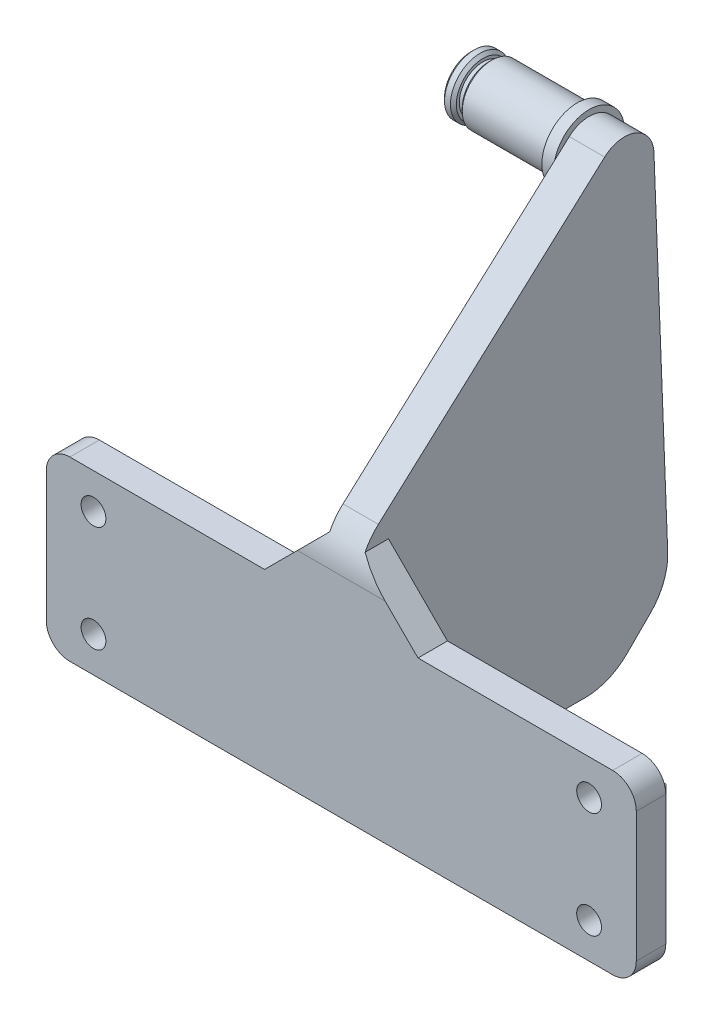
from build123d import *

# Parameters (mm, degrees)
SKETCH1_W           = 100
SKETCH1_H           = 30
BOSS_EXTRUDE1_DEPTH = 5
SKETCH2_W           = 6
SKETCH2_H           = 50
BOSS_EXTRUDE2_DEPTH = 30
SKETCH3_W           = 6
SKETCH3_H           = 52.5
BOSS_EXTRUDE3_DEPTH = 50
SKETCH4_R           = 5
BOSS_EXTRUDE4_DEPTH = 20
CHAMFER1_SIZE       = 10
FILLET1_R           = 10
CHAMFER2_SIZE       = 10
FILLET2_R           = 4
SKETCH5_W           = 100
SKETCH5_H           = 5
BOSS_EXTRUDE5_DEPTH = 10
CHAMFER3_SIZE       = 10
SKETCH7_R           = 2.1
CUT_EXTRUDE1_DEPTH  = 137.587883796
CUT_EXTRUDE2_DEPTH  = 108.075907654
FILLET3_R           = 10
SKETCH9_R           = 6
BOSS_EXTRUDE6_DEPTH = 2
CHAMFER4_SIZE       = 0.5
CUT_EXTRUDE3_START  = 1
SKETCH10_R          = 5
SKETCH10_R_2        = 4
CUT_EXTRUDE3_DEPTH  = 1
CHAMFER5_SIZE       = 0.5


with BuildPart() as part:
    # Sketch1 → Boss-Extrude1 (new body)
    with BuildSketch(Plane.XY):
        with Locations((50, 15)):
            Rectangle(SKETCH1_W, SKETCH1_H)
    extrude(amount=BOSS_EXTRUDE1_DEPTH)

    # Sketch2 → Boss-Extrude2 (add)
    with BuildSketch(Plane(origin=(0, 30, 0), x_dir=(1, 0, 0), z_dir=(0, 1, 0))):
        with Locations((50, 22.5)):
            Rectangle(SKETCH2_W, SKETCH2_H)
    extrude(amount=-BOSS_EXTRUDE2_DEPTH)

    # Sketch3 → Boss-Extrude3 (add)
    with BuildSketch(Plane(origin=(0, 30, 0), x_dir=(1, 0, 0), z_dir=(0, 1, 0))):
        with Locations((50, 21.25)):
            Rectangle(SKETCH3_W, SKETCH3_H)
    extrude(amount=BOSS_EXTRUDE3_DEPTH)

    # Sketch4 → Boss-Extrude4 (add)
    with BuildSketch(Plane.ZY.offset(-47)):
        with Locations((-40, 74)):
            Circle(SKETCH4_R)
    extrude(amount=BOSS_EXTRUDE4_DEPTH)

    # Chamfer1
    chamfer1_edges = [part.edges().sort_by_distance(p)[0] for p in [
        (50, 0, -47.5),
    ]]
    chamfer(chamfer1_edges, length=CHAMFER1_SIZE)

    # Fillet1
    fillet1_edges = [part.edges().sort_by_distance(p)[0] for p in [
        (50, 80, 5),
        (50, 80, -47.5),
    ]]
    fillet(fillet1_edges, radius=FILLET1_R)

    # Chamfer2
    chamfer2_edges = [part.edges().sort_by_distance(p)[0] for p in [
        (47, 30, 2.5),
        (53, 30, 2.5),
    ]]
    chamfer(chamfer2_edges, length=CHAMFER2_SIZE)

    # Fillet2
    fillet2_edges = [part.edges().sort_by_distance(p)[0] for p in [
        (0, 0, 2.5),
        (100, 0, 2.5),
        (100, 30, 2.5),
        (0, 30, 2.5),
    ]]
    fillet(fillet2_edges, radius=FILLET2_R)

    # Sketch5 → Boss-Extrude5 (add)
    with BuildSketch(Plane(origin=(0, 0, 0), x_dir=(-1, 0, 0), z_dir=(0, 0, -1))):
        with Locations((-50, 15)):
            Rectangle(SKETCH5_W, SKETCH5_H)
    extrude(amount=BOSS_EXTRUDE5_DEPTH)

    # Chamfer3
    chamfer3_edges = [part.edges().sort_by_distance(p)[0] for p in [
        (0, 15, -10),
        (100, 15, -10),
    ]]
    chamfer(chamfer3_edges, length=CHAMFER3_SIZE)

    # Sketch7 → Cut-Extrude1 (cut, through all)
    with BuildSketch(Plane(origin=(0, 0, 0), x_dir=(-1, 0, 0), z_dir=(0, 0, -1))):
        with Locations((-92, 24)):
            Circle(SKETCH7_R)
        with Locations((-8, 24)):
            Circle(SKETCH7_R)
        with Locations((-8, 6)):
            Circle(SKETCH7_R)
        with Locations((-92, 6)):
            Circle(SKETCH7_R)
    extrude(amount=-CUT_EXTRUDE1_DEPTH, mode=Mode.SUBTRACT)

    # Sketch8 → Cut-Extrude2 (cut, through all)
    with BuildSketch(Plane.ZY.offset(-47)):
        with BuildLine():
            Line((-36.644039957, 77.706417703), (5, 40))
            Line((5, 40), (5, 70))
            ThreePointArc((5, 70), (2.071067812, 77.071067812), (-5, 80))
            Line((-5, 80), (-37.5, 80))
            ThreePointArc((-37.5, 80), (-44.571067812, 77.071067812), (-47.5, 70))
            Line((-47.5, 70), (-47.5, 10))
            Line((-47.5, 10), (-44.996201229, 74.194867332))
            ThreePointArc((-44.996201229, 74.194867332), (-41.937871072, 78.609192522), (-36.644039957, 77.706417703))
        make_face()
    extrude(amount=-CUT_EXTRUDE2_DEPTH, mode=Mode.SUBTRACT)

    # Fillet3
    fillet3_edges = [part.edges().sort_by_distance(p)[0] for p in [
        (50, 40, 5),
        (50, 0, -37.5),
        (50, 10, -47.5),
    ]]
    fillet(fillet3_edges, radius=FILLET3_R)

    # Sketch9 → Boss-Extrude6 (add)
    with BuildSketch(Plane.ZY.offset(-47)):
        with Locations(Location((-40, 74, 0), (0, 0, 211.323728943))):
            Circle(SKETCH9_R)
    extrude(amount=BOSS_EXTRUDE6_DEPTH)

    # Chamfer4
    chamfer4_edges = [part.edges().sort_by_distance(p)[0] for p in [
        (27, 74, -45),
    ]]
    chamfer(chamfer4_edges, length=CHAMFER4_SIZE)

    # Sketch10 → Cut-Extrude3 (cut)
    with BuildSketch(Plane.ZY.offset(-30).offset(CUT_EXTRUDE3_START)):
        with Locations((-40, 74)):
            Circle(SKETCH10_R)
        with Locations((-40, 74)):
            Circle(SKETCH10_R_2, mode=Mode.SUBTRACT)
    extrude(amount=-CUT_EXTRUDE3_DEPTH, mode=Mode.SUBTRACT)

    # Chamfer5
    chamfer5_edges = [part.edges().sort_by_distance(p)[0] for p in [
        (29, 74, -45),
        (30, 74, -45),
    ]]
    chamfer(chamfer5_edges, length=CHAMFER5_SIZE)


solid = part.part
